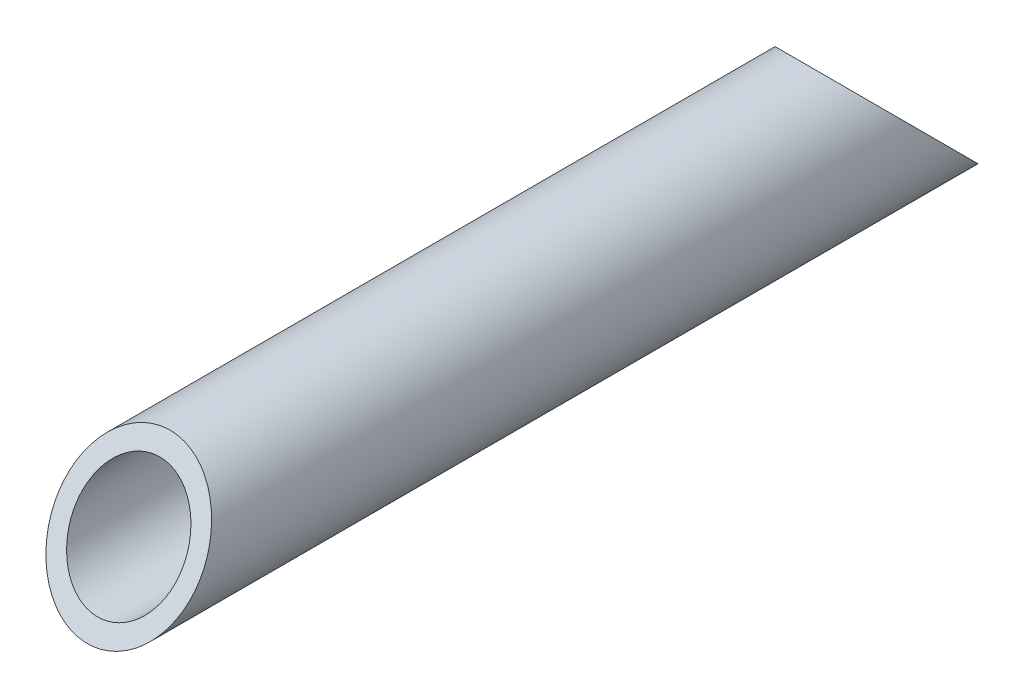
from build123d import *

# Parameters (mm, degrees)
SKETCH1_R           = 6.35
SKETCH1_R_2         = 4.7625
BOSS_EXTRUDE1_DEPTH = 76.2
CUT_EXTRUDE1_DEPTH  = 38.1
CUT_EXTRUDE3_DEPTH  = 38.1


with BuildPart() as part:
    # Sketch1 → Boss-Extrude1 (new body)
    with BuildSketch(Plane.XY):
        with Locations(Location((0, 0, 0), (0, 0, 180))):
            Circle(SKETCH1_R)
        with Locations(Location((0, 0, 0), (0, 0, 180))):
            Circle(SKETCH1_R_2, mode=Mode.SUBTRACT)
    extrude(amount=BOSS_EXTRUDE1_DEPTH)

    # Sketch2 → Cut-Extrude1 (cut, symmetric)
    with BuildSketch(Plane(origin=(0, 0, 0), x_dir=(0, 0, -1), z_dir=(1, 0, 0))):
        Polygon((-76.2, -6.35), (-68.867651581, 6.35), (-76.2, 6.35), align=None)
    extrude(amount=CUT_EXTRUDE1_DEPTH, both=True, mode=Mode.SUBTRACT)

    # Sketch3 → Cut-Extrude3 (cut, symmetric)
    with BuildSketch(Plane(origin=(0, 0, 0), x_dir=(0, 0, -1), z_dir=(1, 0, 0))):
        Polygon((-12.7, 6.35), (0, -6.35), (0, 6.35), align=None)
    extrude(amount=CUT_EXTRUDE3_DEPTH, both=True, mode=Mode.SUBTRACT)


solid = part.part
